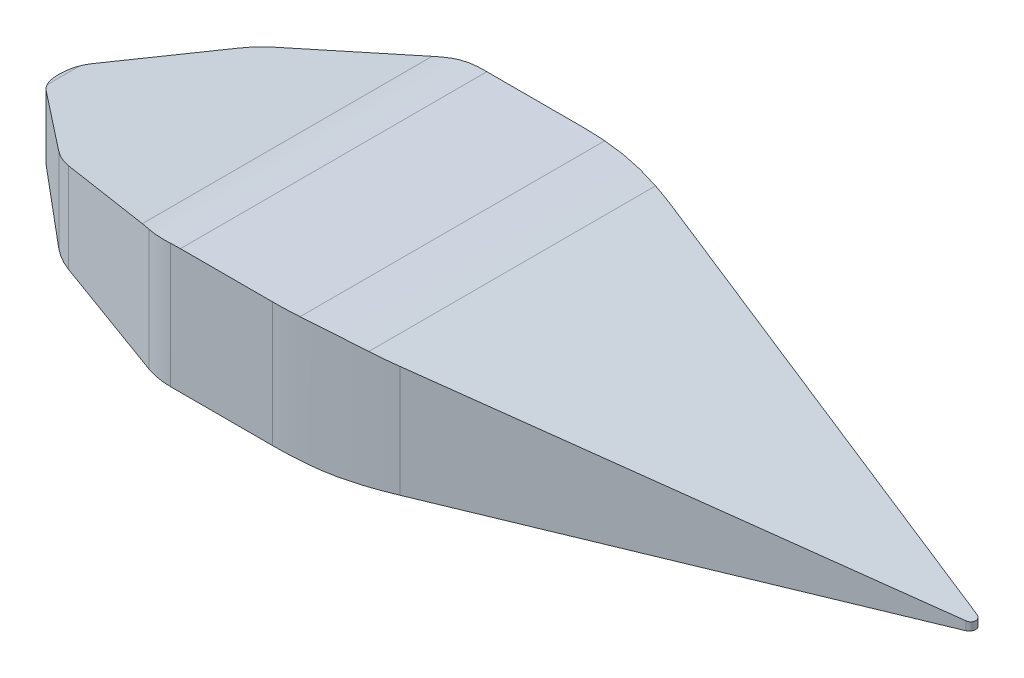
from build123d import *

# Parameters (mm, degrees)
TOPVIEW_EXTRUDE_DEPTH      = 800
SIDEPROFILE_CUT_DEPTH      = 5006.775642449
SIDEPROFILE_CUT_DEPTH_BACK = 5006.775642449
SKETCH2_OUTSIDE_W          = 5811.458
SKETCH2_OUTSIDE_H          = 1824.126


with BuildPart() as part:
    # Sketch1 → TopView_Extrude (new body)
    with BuildSketch(Plane(origin=(0, 0, 0), x_dir=(1, 0, 0), z_dir=(0, 1, 0))):
        with BuildLine():
            Line((146.069849076, 122.567124227), (556.148324977, 466.663731547))
            ThreePointArc((556.148324977, 466.663731547), (613.263316637, 506.656075273), (676.455195963, 536.122941687))
            Line((676.455195963, 536.122941687), (1335.173700718, 775.877020708))
            ThreePointArc((1335.173700718, 775.877020708), (1402.522523085, 793.923094197), (1471.981833896, 800))
            Line((1471.981833896, 800), (2005.990858989, 800))
            ThreePointArc((2005.990858989, 800), (2298.278743763, 778.526672151), (2584.290234961, 714.567792414))
            Line((2584.290234961, 714.567792414), (4854.922001024, 28.718516886))
            ThreePointArc((4854.922001024, 28.718516886), (4876.247510385, 0), (4854.922001024, -28.718516886))
            Line((4854.922001024, -28.718516886), (2584.290234961, -714.567792414))
            ThreePointArc((2584.290234961, -714.567792414), (2298.278743763, -778.526672151), (2005.990858989, -800))
            Line((2005.990858989, -800), (1471.981833896, -800))
            ThreePointArc((1471.981833896, -800), (1402.522523085, -793.923094197), (1335.173700718, -775.877020708))
            Line((1335.173700718, -775.877020708), (676.455195963, -536.122941687))
            ThreePointArc((676.455195963, -536.122941687), (613.263316637, -506.656075273), (556.148324977, -466.663731547))
            Line((556.148324977, -466.663731547), (146.069849076, -122.567124227))
            ThreePointArc((146.069849076, -122.567124227), (88.915850742, 0), (146.069849076, 122.567124227))
        make_face()
    extrude(amount=TOPVIEW_EXTRUDE_DEPTH)

    # Sketch2 outside → SideProfile_Cut (cut, two sides: drawn at the far end of the back side and taken through both)
    with BuildSketch(Plane.XY.offset(-SIDEPROFILE_CUT_DEPTH_BACK)):
        with Locations((2482.582, 400)):
            Rectangle(SKETCH2_OUTSIDE_W, SKETCH2_OUTSIDE_H)
        with BuildLine():
            Line((0, 300), (0, 332.854125267))
            ThreePointArc((0, 332.854125267), (31.780430043, 425.180358155), (113.65511039, 478.384359237))
            Line((113.65511039, 478.384359237), (1282.133703367, 770.201559797))
            ThreePointArc((1282.133703367, 770.201559797), (1402.370605908, 792.522432945), (1524.432967436, 800))
            Line((1524.432967436, 800), (2144.482683126, 800))
            ThreePointArc((2144.482683126, 800), (2300.969778196, 793.868548595), (2456.497380248, 775.511789076))
            Line((2456.497380248, 775.511789076), (4950, 381.685))
            Line((4950, 381.685), (4950, 359.158))
            Line((4950, 359.158), (2419.355991101, 159.311049986))
            ThreePointArc((2419.355991101, 159.311049986), (2301.359194606, 152.328666278), (2183.178929847, 150))
            Line((2183.178929847, 150), (150, 150))
            ThreePointArc((150, 150), (43.933982822, 193.933982822), (0, 300))
        make_face(mode=Mode.SUBTRACT)
    extrude(amount=SIDEPROFILE_CUT_DEPTH + SIDEPROFILE_CUT_DEPTH_BACK, mode=Mode.SUBTRACT)


solid = part.part
